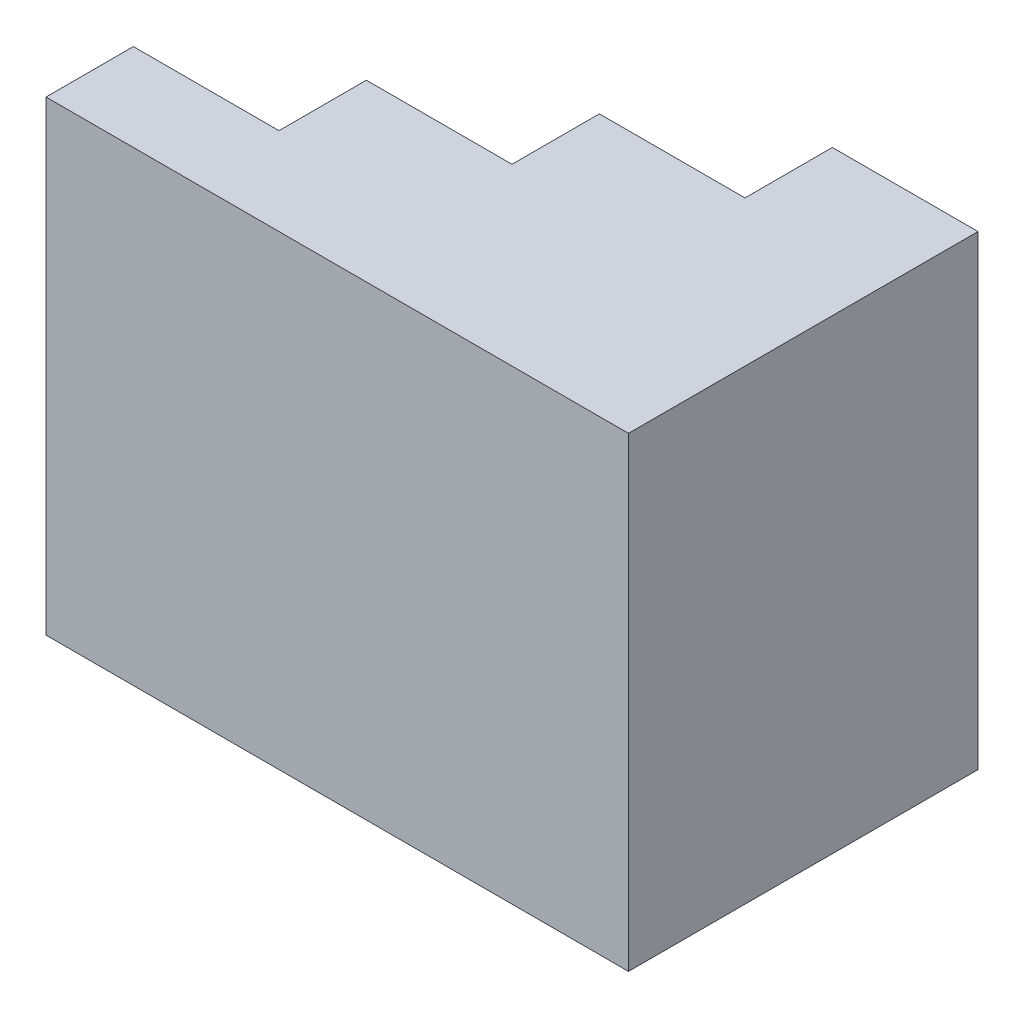
from build123d import *

# Parameters (mm, degrees)
SKETCH1_W           = 100
SKETCH1_H           = 80
BOSS_EXTRUDE1_DEPTH = 60
CUT_EXTRUDE2_DEPTH  = 60


with BuildPart() as part:
    # Sketch1 → Boss-Extrude1 (new body)
    with BuildSketch(Plane.XY):
        with Locations((50, 40)):
            Rectangle(SKETCH1_W, SKETCH1_H)
    extrude(amount=BOSS_EXTRUDE1_DEPTH)

    # Sketch5 → Cut-Extrude2 (cut)
    with BuildSketch(Plane(origin=(0, 80, 0), x_dir=(1, 0, 0), z_dir=(0, 1, 0))):
        Polygon((0, 0), (75, 0), (75, -15), (50, -15), (50, -30), (25, -30), (25, -45), (0, -45), align=None)
    extrude(amount=-CUT_EXTRUDE2_DEPTH, mode=Mode.SUBTRACT)


solid = part.part
